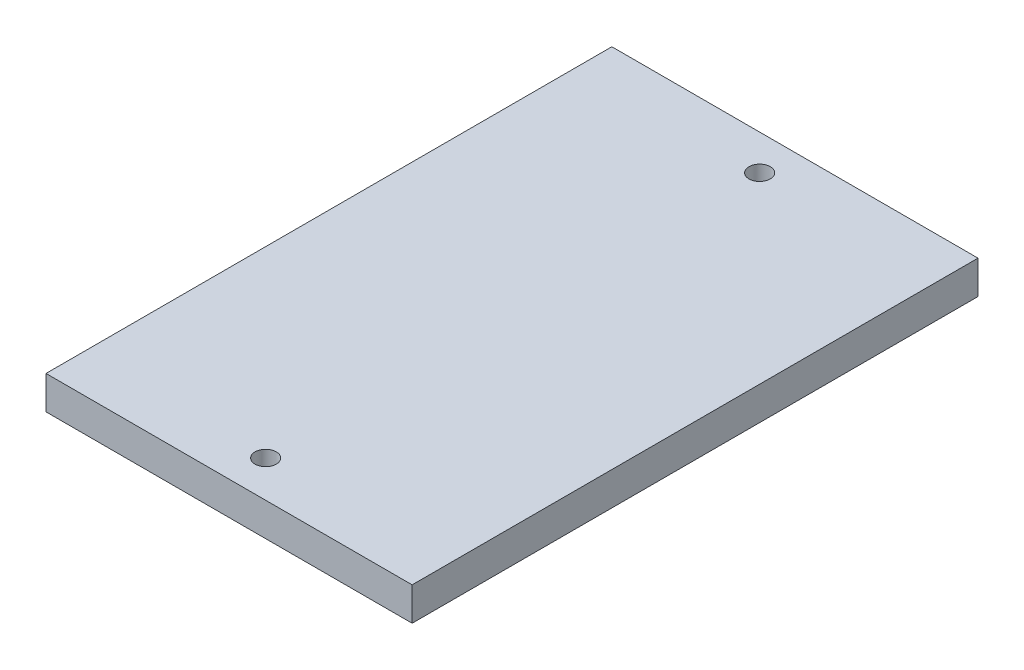
from build123d import *

# Parameters (mm, degrees)
SKETCH1_W           = 55
SKETCH1_H           = 85
SKETCH1_R           = 1.6
BOSS_EXTRUDE1_DEPTH = 5


with BuildPart() as part:
    # Sketch1 → Boss-Extrude1 (new body)
    with BuildSketch(Plane(origin=(0, 0, 0), x_dir=(1, 0, 0), z_dir=(0, 1, 0))):
        Rectangle(SKETCH1_W, SKETCH1_H)
        with Locations(Location((0, -37, 0), (0, 0, 270))):
            Circle(SKETCH1_R, mode=Mode.SUBTRACT)
        with Locations(Location((0, 37.2, 0), (0, 0, 90))):
            Circle(SKETCH1_R, mode=Mode.SUBTRACT)
    extrude(amount=BOSS_EXTRUDE1_DEPTH)


solid = part.part
